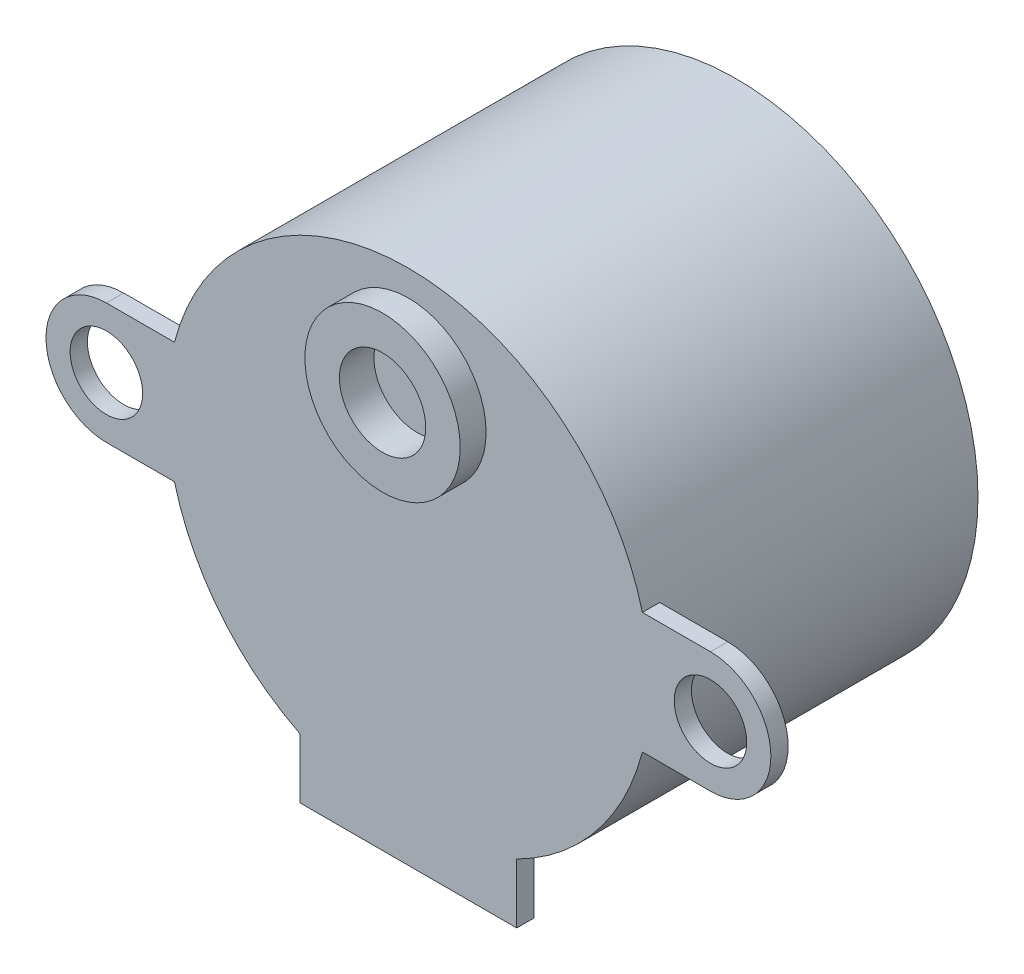
from build123d import *
from build123d.topology import SkipClean

# Parameters (mm, degrees)
ESQUISSE1_R             = 2.1
BOSS_EXTRU_1_DEPTH      = 19
ENL_V_START             = -18
ENL_V_MAT_EXTRU_1_DEPTH = 18
ESQUISSE3_R             = 4.5
BOSS_EXTRU_2_DEPTH      = 1.5
ESQUISSE4_R             = 2.5
ENL_V_MAT_EXTRU_2_DEPTH = 2
BOSS_EXTRU_3_DEPTH      = 1


with BuildPart() as part:
    # Esquisse1 → Boss.-Extru.1 (new body)
    with BuildSketch(Plane.XY):
        with BuildLine():
            Line((13.555441712, 3.5), (17.5, 3.5))
            ThreePointArc((17.5, 3.5), (21, 0), (17.5, -3.5))
            Line((17.5, -3.5), (13.555441712, -3.5))
            ThreePointArc((13.555441712, -3.5), (0, -14), (-13.555441712, -3.5))
            Line((-13.555441712, -3.5), (-17.5, -3.5))
            ThreePointArc((-17.5, -3.5), (-21, 0), (-17.5, 3.5))
            Line((-17.5, 3.5), (-13.555441712, 3.5))
            ThreePointArc((-13.555441712, 3.5), (0, 14), (13.555441712, 3.5))
        make_face()
        with Locations((-17.5, 0)):
            Circle(ESQUISSE1_R, mode=Mode.SUBTRACT)
        with Locations((17.5, 0)):
            Circle(ESQUISSE1_R, mode=Mode.SUBTRACT)
    extrude(amount=-BOSS_EXTRU_1_DEPTH)

    # Esquisse2 → Enlèv. mat.-Extru.1 (cut)
    with SkipClean():  # the faces are left unmerged after this step: merging them gives an invalid solid
        with BuildSketch(Plane(origin=(0, 0, -19), x_dir=(-1, 0, 0), z_dir=(0, 0, -1)).offset(ENL_V_START)):
            with BuildLine():
                Line((-13.555441712, 3.5), (-17.5, 3.5))
                ThreePointArc((-17.5, 3.5), (-21, 0), (-17.5, -3.5))
                Line((-17.5, -3.5), (-13.555441712, -3.5))
                ThreePointArc((-13.555441712, -3.5), (-14, 0), (-13.555441712, 3.5))
            make_face()
            with BuildLine():
                Line((13.555441712, 3.5), (17.5, 3.5))
                ThreePointArc((17.5, 3.5), (21, 0), (17.5, -3.5))
                Line((17.5, -3.5), (13.555441712, -3.5))
                ThreePointArc((13.555441712, -3.5), (14, 0), (13.555441712, 3.5))
            make_face()
        extrude(amount=ENL_V_MAT_EXTRU_1_DEPTH, mode=Mode.SUBTRACT)

    # Esquisse3 → Boss.-Extru.2 (add)
    with SkipClean():  # the faces are left unmerged after this step: merging them gives an invalid solid
        with BuildSketch(Plane.XY):
            with Locations((0, 8)):
                Circle(ESQUISSE3_R)
        extrude(amount=BOSS_EXTRU_2_DEPTH)

    # Esquisse4 → Enlèv. mat.-Extru.2 (cut)
    with SkipClean():  # the faces are left unmerged after this step: merging them gives an invalid solid
        with BuildSketch(Plane.XY.offset(1.5)):
            with Locations((0, 8)):
                Circle(ESQUISSE4_R)
        extrude(amount=-ENL_V_MAT_EXTRU_2_DEPTH, mode=Mode.SUBTRACT)

    # Esquisse5 → Boss.-Extru.3 (add)
    with SkipClean():  # the faces are left unmerged after this step: merging them gives an invalid solid
        with BuildSketch(Plane.XY):
            with BuildLine():
                Line((-6.275, -15.975), (6.275, -15.975))
                Line((6.275, -15.975), (6.275, -12.514966041))
                ThreePointArc((6.275, -12.514966041), (0, -14), (-6.275, -12.514966041))
                Line((-6.275, -12.514966041), (-6.275, -15.975))
            make_face()
        extrude(amount=-BOSS_EXTRU_3_DEPTH)


solid = part.part
